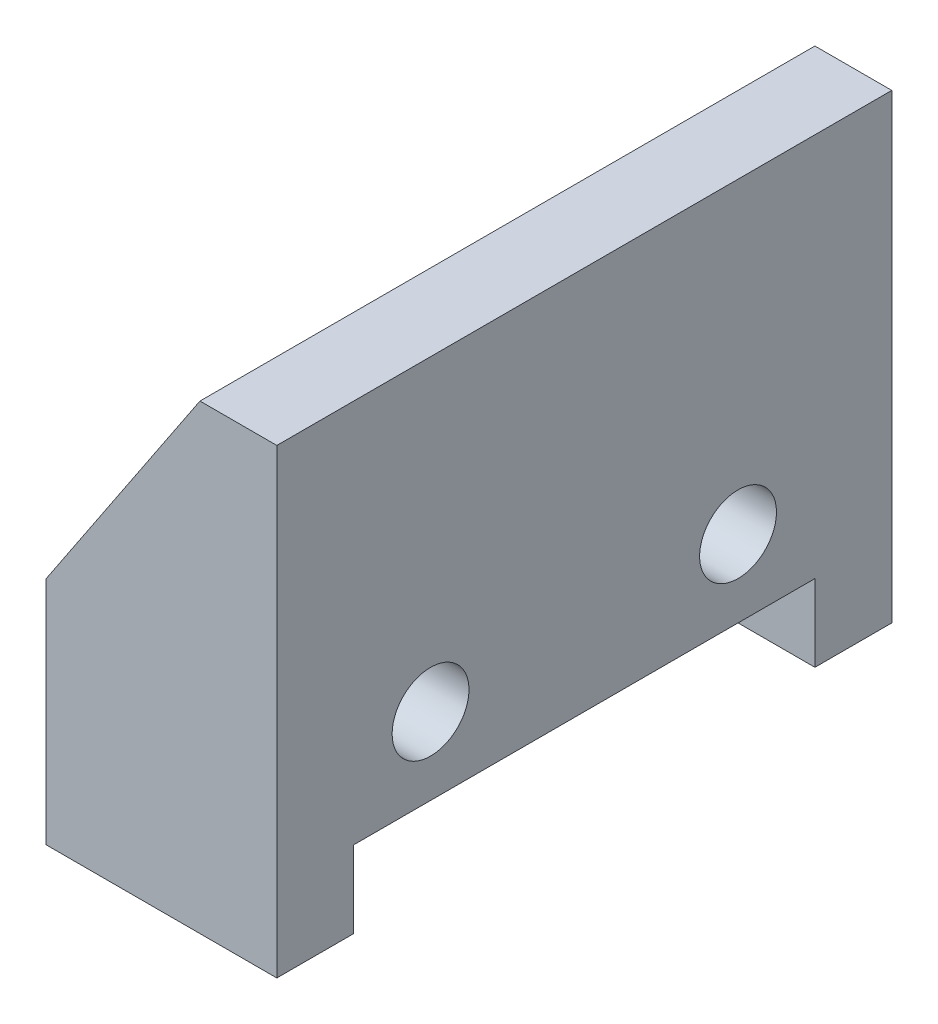
from build123d import *

# Parameters (mm, degrees)
BOSS_EXTRUDE1_DEPTH = 20
SKETCH2_R           = 2.5
SKETCH2_W           = 30
SKETCH2_H           = 5
CUT_EXTRUDE1_DEPTH  = 40.05124838


with BuildPart() as part:
    # Sketch1 → Boss-Extrude1 (new, symmetric)
    with BuildSketch(Plane.XY):
        Polygon((0, 0), (15, 0), (15, 30), (10, 30), (0, 15), align=None)
    extrude(amount=BOSS_EXTRUDE1_DEPTH, both=True)

    # Sketch2 → Cut-Extrude1 (cut, through all)
    with BuildSketch(Plane(origin=(15, 0, 0), x_dir=(0, 0, -1), z_dir=(1, 0, 0))):
        with Locations((10, 10)):
            Circle(SKETCH2_R)
        with Locations(Location((-10, 10, 0), (0, 0, 180))):
            Circle(SKETCH2_R)
        with Locations((0, 2.5)):
            Rectangle(SKETCH2_W, SKETCH2_H)
    extrude(amount=-CUT_EXTRUDE1_DEPTH, mode=Mode.SUBTRACT)


solid = part.part
